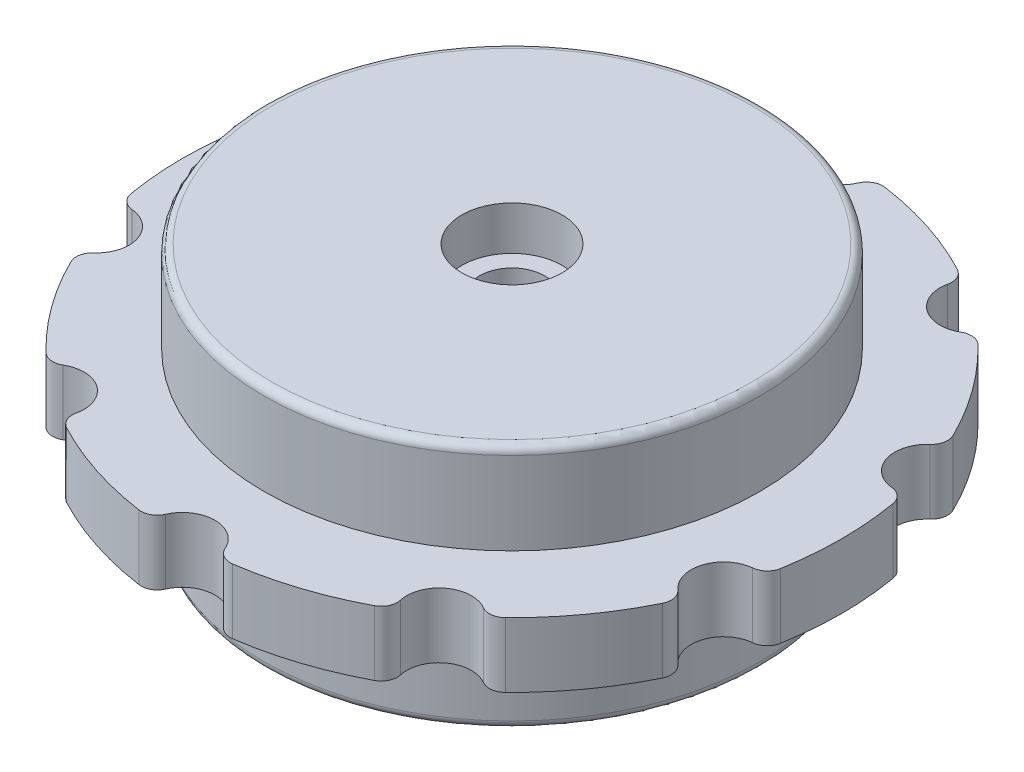
from build123d import *

# Parameters (mm, degrees)
SKETCH_1_R                       = 15.3
SKETCH_1_R_2                     = 13.7
EXTRUDE_1_DEPTH                  = 7.6
SKETCH_1_3_R                     = 20.35
EXTRUDE_2_DEPTH                  = 2
SKETCH_1_4_R                     = 2
CUT_EXTRUDE_1_DEPTH              = 30.765836121
FILLET_1_R                       = 1
PATTERN_CIRCULAR_1_COUNT         = 10
FILLET_1_OF_PATTERN_CIRCULAR_1_R = 1
FILLET_2_R                       = 0.5
SKETCH_1_5_R                     = 13.7
EXTRUDE_3_DEPTH                  = 3.9
EXTRUDE_START                    = -7.6
SKETCH_1_6_R                     = 13.7
EXTRUDE_5_DEPTH                  = 15.2
SKETCH_4_R                       = 2
CUT_EXTRUDE_3_DEPTH              = 33.42412133
SKETCH_4_3_R                     = 3.1
CUT_EXTRUDE_4_DEPTH              = 2.7
CUT_EXTRUDE_START                = -12.5
SKETCH_4_4_R                     = 3.1
CUT_EXTRUDE_5_DEPTH              = 2.7
SKETCH_5_R                       = 13
CUT_EXTRUDE_6_DEPTH              = 4.5
SKETCH_6_R                       = 2.75
CUT_EXTRUDE_7_DEPTH              = 2
SKETCH_7_R                       = 0.35
CUT_EXTRUDE_8_DEPTH              = 5


with BuildPart() as part:
    # 草图1 → 凸台-拉伸1 (new, symmetric)
    with BuildSketch(Plane(origin=(0, 0, 0), x_dir=(1, 0, 0), z_dir=(0, 1, 0))):
        with Locations(Location((0, 0, 0), (0, 0, 90))):
            Circle(SKETCH_1_R)
        with Locations(Location((0, 0, 0), (0, 0, 90))):
            Circle(SKETCH_1_R_2, mode=Mode.SUBTRACT)
    extrude(amount=EXTRUDE_1_DEPTH, both=True)

    # 草图1<3> → 凸台-拉伸2 (add, symmetric)
    with BuildSketch(Plane(origin=(0, 0, 0), x_dir=(1, 0, 0), z_dir=(0, 1, 0))):
        with Locations(Location((0, 0, 0), (0, 0, 270))):
            Circle(SKETCH_1_3_R)
    extrude(amount=EXTRUDE_2_DEPTH, both=True)

    # 草图1<4> → 切除-拉伸1 (cut, symmetric)
    with BuildSketch(Plane(origin=(0, 0, 0), x_dir=(1, 0, 0), z_dir=(0, 1, 0))):
        with Locations((0, 20.35)):
            Circle(SKETCH_1_4_R)
    cut_extrude_1 = extrude(amount=CUT_EXTRUDE_1_DEPTH, both=True, mode=Mode.SUBTRACT)

    # 圆角1
    fillet_1_edges = [part.edges().sort_by_distance(p)[0] for p in [
        (-1.997583796, 0, -20.251719902),
        (1.997583796, 0, -20.251719902),
    ]]
    fillet(fillet_1_edges, radius=FILLET_1_R)

    # 阵列(圆周)1: 切除-拉伸1 ×10 about axis
    pattern_circular_1_axis = Axis((0, 0, 0), (0, 1, 0))
    for i in range(1, PATTERN_CIRCULAR_1_COUNT):
        add(cut_extrude_1.rotate(pattern_circular_1_axis, i * 360 / PATTERN_CIRCULAR_1_COUNT), mode=Mode.SUBTRACT)

    # 圆角1 of 阵列(圆周)1
    fillet_1_of_pattern_circular_1_edges = [part.edges().sort_by_distance(p)[0] for p in [
        (-13.51974153, 0, -15.20983527),
        (-10.287583053, 0, -17.558135861),
        (-19.877817519, 0, -4.358310529),
        (-18.643242838, 0, -8.157940701),
        (-18.643242838, 0, 8.157940701),
        (-19.877817519, 0, 4.358310529),
        (-10.287583053, 0, 17.558135861),
        (-13.51974153, 0, 15.20983527),
        (1.997583796, 0, 20.251719902),
        (-1.997583796, 0, 20.251719902),
        (13.51974153, 0, 15.20983527),
        (10.287583053, 0, 17.558135861),
        (19.877817519, 0, 4.358310529),
        (18.643242838, 0, 8.157940701),
        (18.643242838, 0, -8.157940701),
        (19.877817519, 0, -4.358310529),
        (10.287583053, 0, -17.558135861),
        (13.51974153, 0, -15.20983527),
    ]]
    fillet(fillet_1_of_pattern_circular_1_edges, radius=FILLET_1_OF_PATTERN_CIRCULAR_1_R)

    # 圆角2
    fillet_2_edges = [part.edges().sort_by_distance(p)[0] for p in [
        (0, -7.6, 15.3),
        (0, 7.6, 15.3),
    ]]
    fillet(fillet_2_edges, radius=FILLET_2_R)

    # 草图1<5> → 凸台-拉伸3 (add, symmetric)
    with BuildSketch(Plane(origin=(0, 0, 0), x_dir=(1, 0, 0), z_dir=(0, 1, 0))):
        with Locations(Location((0, 0, 0), (0, 0, 90))):
            Circle(SKETCH_1_5_R)
    extrude(amount=EXTRUDE_3_DEPTH, both=True)

    # 草图1<6> → 凸台-拉伸5 (add)
    with BuildSketch(Plane(origin=(0, 0, 0), x_dir=(1, 0, 0), z_dir=(0, 1, 0)).offset(EXTRUDE_START)):
        Circle(SKETCH_1_6_R)
    extrude(amount=EXTRUDE_5_DEPTH)

    # 草图4 → 切除-拉伸3 (cut, through all)
    with BuildSketch(Plane.XZ.offset(7.6)):
        with Locations(Location((0, 0, 0), (0, 0, 270))):
            Circle(SKETCH_4_R)
    extrude(amount=-CUT_EXTRUDE_3_DEPTH, mode=Mode.SUBTRACT)

    # 草图4<3> → 切除-拉伸4 (cut)
    with BuildSketch(Plane.XZ.offset(7.6)):
        with Locations(Location((0, 0, 0), (0, 0, 270))):
            Circle(SKETCH_4_3_R)
    extrude(amount=-CUT_EXTRUDE_4_DEPTH, mode=Mode.SUBTRACT)

    # 草图4<4> → 切除-拉伸5 (cut)
    with BuildSketch(Plane.XZ.offset(7.6).offset(CUT_EXTRUDE_START)):
        with Locations(Location((0, 0, 0), (0, 0, 270))):
            Circle(SKETCH_4_4_R)
    extrude(amount=-CUT_EXTRUDE_5_DEPTH, mode=Mode.SUBTRACT)

    # 草图5 → 切除-拉伸6 (cut)
    with BuildSketch(Plane.XZ.offset(7.6)):
        with Locations(Location((0, 0, 0), (0, 0, 270))):
            Circle(SKETCH_5_R)
    extrude(amount=-CUT_EXTRUDE_6_DEPTH, mode=Mode.SUBTRACT)

    # 草图6 → 切除-拉伸7 (cut)
    with BuildSketch(Plane.XZ.offset(3.1)):
        with Locations(Location((0, 0, 0), (0, 0, 270))):
            Circle(SKETCH_6_R)
    extrude(amount=-CUT_EXTRUDE_7_DEPTH, mode=Mode.SUBTRACT)

    # 草图7 → 切除-拉伸8 (cut)
    with BuildSketch(Plane.XZ.offset(3.1)):
        with Locations(Location((-10, 0, 0), (0, 0, 270))):
            Circle(SKETCH_7_R)
        with Locations(Location((5, 8.660254038, 0), (0, 0, 270))):
            Circle(SKETCH_7_R)
        with Locations(Location((5, -8.660254038, 0), (0, 0, 270))):
            Circle(SKETCH_7_R)
    extrude(amount=-CUT_EXTRUDE_8_DEPTH, mode=Mode.SUBTRACT)


solid = part.part
